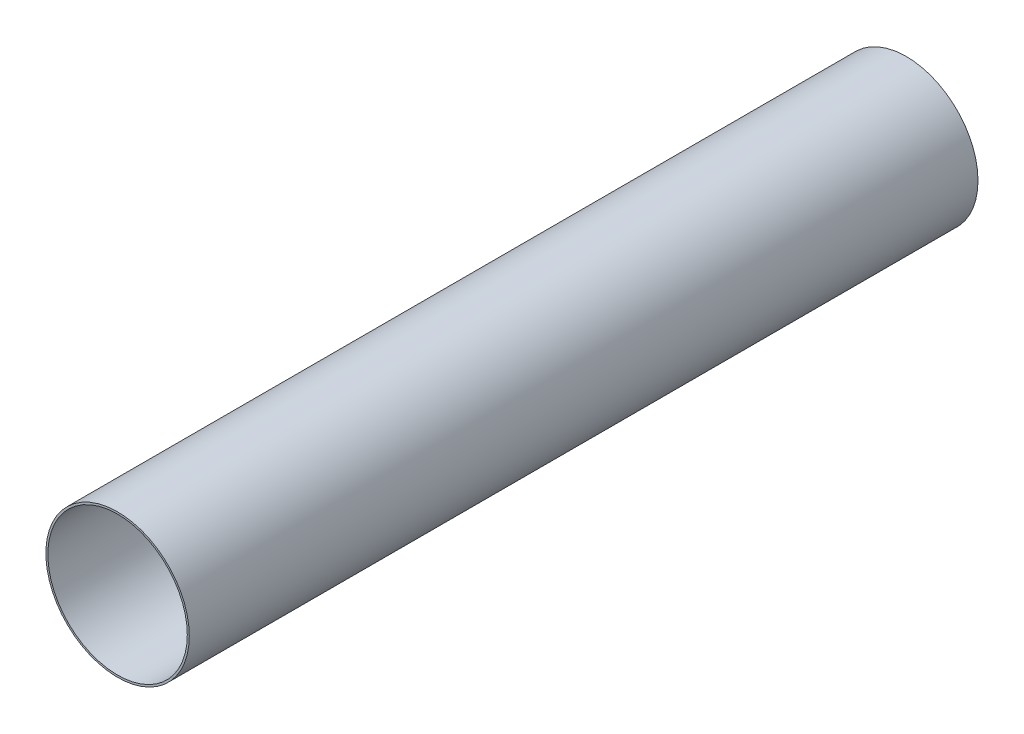
from build123d import *

# Parameters (mm, degrees)
ESQUISSE1_R        = 50.8
ESQUISSE1_R_2      = 49.403
BOSS_EXTRU_1_DEPTH = 558.8


with BuildPart() as part:
    # Esquisse1 → Boss.-Extru.1 (new body)
    with BuildSketch(Plane.XY):
        Circle(ESQUISSE1_R)
        Circle(ESQUISSE1_R_2, mode=Mode.SUBTRACT)
    extrude(amount=BOSS_EXTRU_1_DEPTH)


solid = part.part
